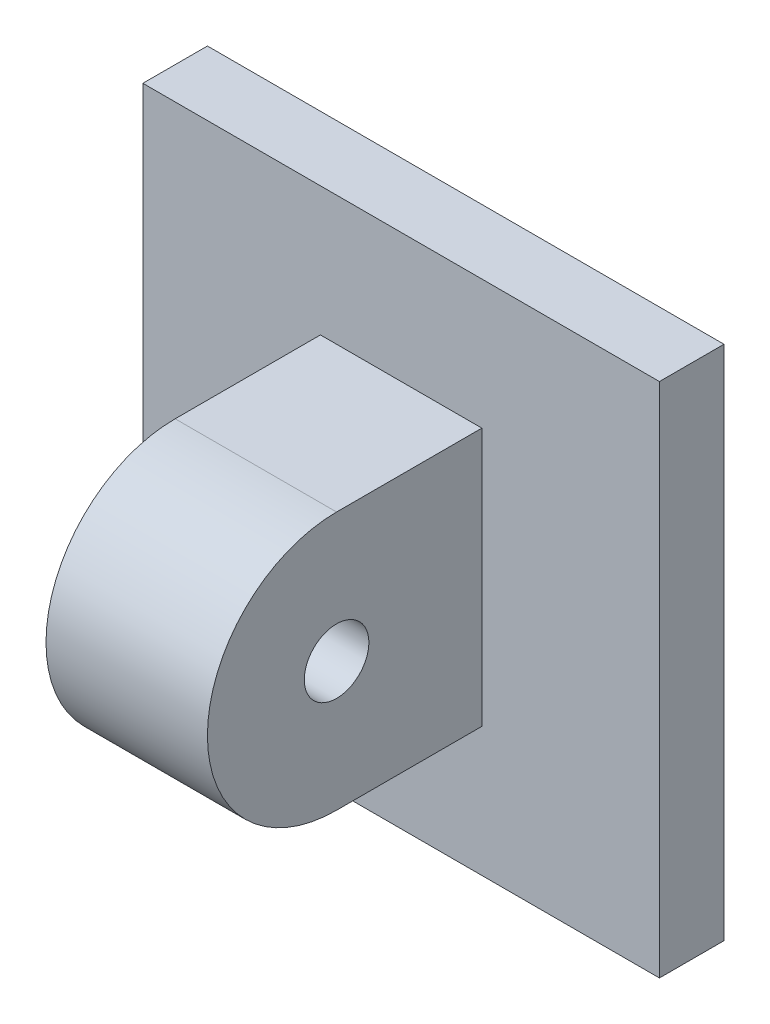
from build123d import *

# Parameters (mm, degrees)
SKETCH_1_W          = 16
SKETCH_1_H          = 16
EXTRUDE_1_DEPTH     = 2
SKETCH_2_W          = 5
SKETCH_2_H          = 8
EXTRUDE_2_DEPTH     = 4.5
SKETCH_3_R          = 4
EXTRUDE_3_DEPTH     = 5
SKETCH_4_R          = 1
CUT_EXTRUDE_1_DEPTH = 10


with BuildPart() as part:
    # 草图1 → 凸台-拉伸1 (new body)
    with BuildSketch(Plane.XY):
        with Locations((8, 8)):
            Rectangle(SKETCH_1_W, SKETCH_1_H)
    extrude(amount=EXTRUDE_1_DEPTH)

    # 草图2 → 凸台-拉伸2 (add)
    with BuildSketch(Plane.XY.offset(2)):
        with Locations((8, 8)):
            Rectangle(SKETCH_2_W, SKETCH_2_H)
    extrude(amount=EXTRUDE_2_DEPTH)

    # 草图3 → 凸台-拉伸3 (add)
    with BuildSketch(Plane.ZY.offset(-5.5)):
        with Locations((6.5, 8)):
            Circle(SKETCH_3_R)
    extrude(amount=-EXTRUDE_3_DEPTH)

    # 草图4 → 切除-拉伸1 (cut)
    with BuildSketch(Plane.ZY.offset(-5.5)):
        with Locations(Location((6.5, 8, 0), (0, 0, 270))):
            Circle(SKETCH_4_R)
    extrude(amount=-CUT_EXTRUDE_1_DEPTH, mode=Mode.SUBTRACT)


solid = part.part
